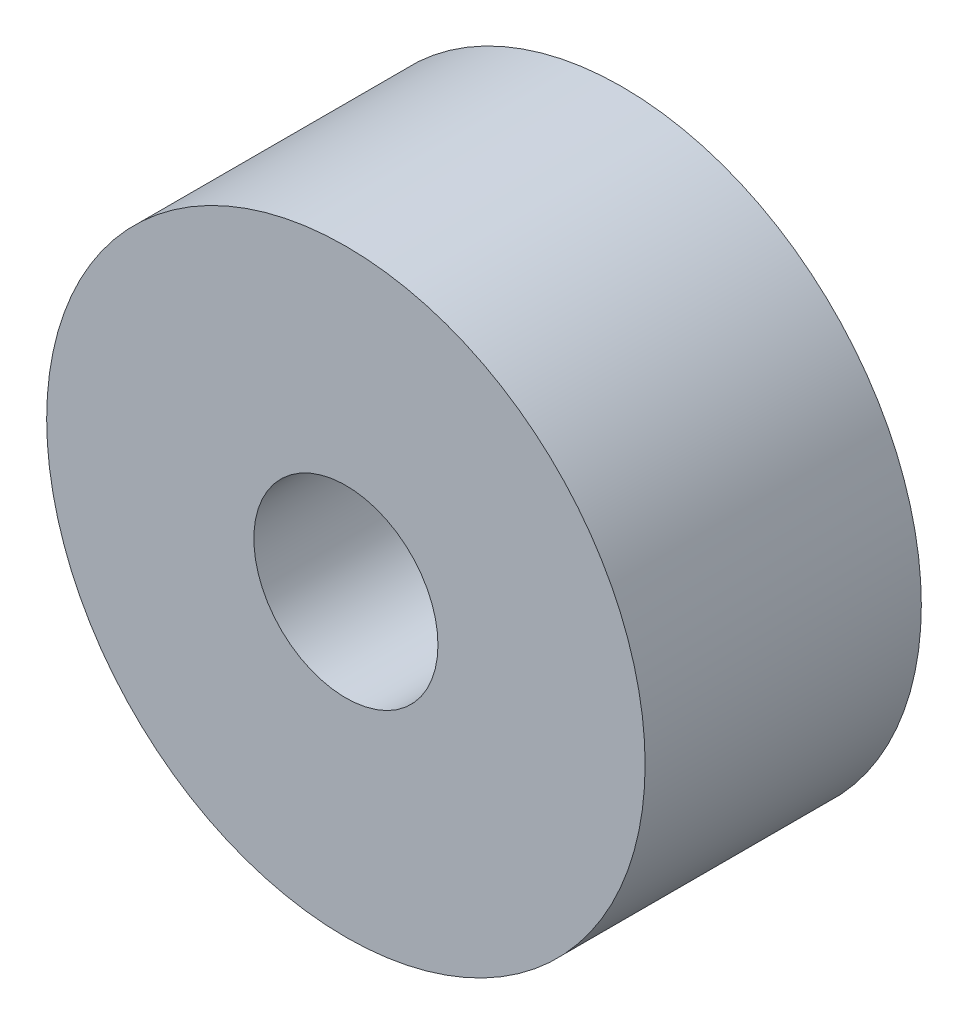
from build123d import *

# Parameters (mm, degrees)
SKETCH1_R           = 6.5
BOSS_EXTRUDE1_DEPTH = 6
SKETCH2_R           = 2
CUT_EXTRUDE1_DEPTH  = 6


with BuildPart() as part:
    # Sketch1 → Boss-Extrude1 (new body)
    with BuildSketch(Plane.XY):
        Circle(SKETCH1_R)
    extrude(amount=BOSS_EXTRUDE1_DEPTH)

    # Sketch2 → Cut-Extrude1 (cut)
    with BuildSketch(Plane.XY.offset(6)):
        Circle(SKETCH2_R)
    extrude(amount=-CUT_EXTRUDE1_DEPTH, mode=Mode.SUBTRACT)


solid = part.part
